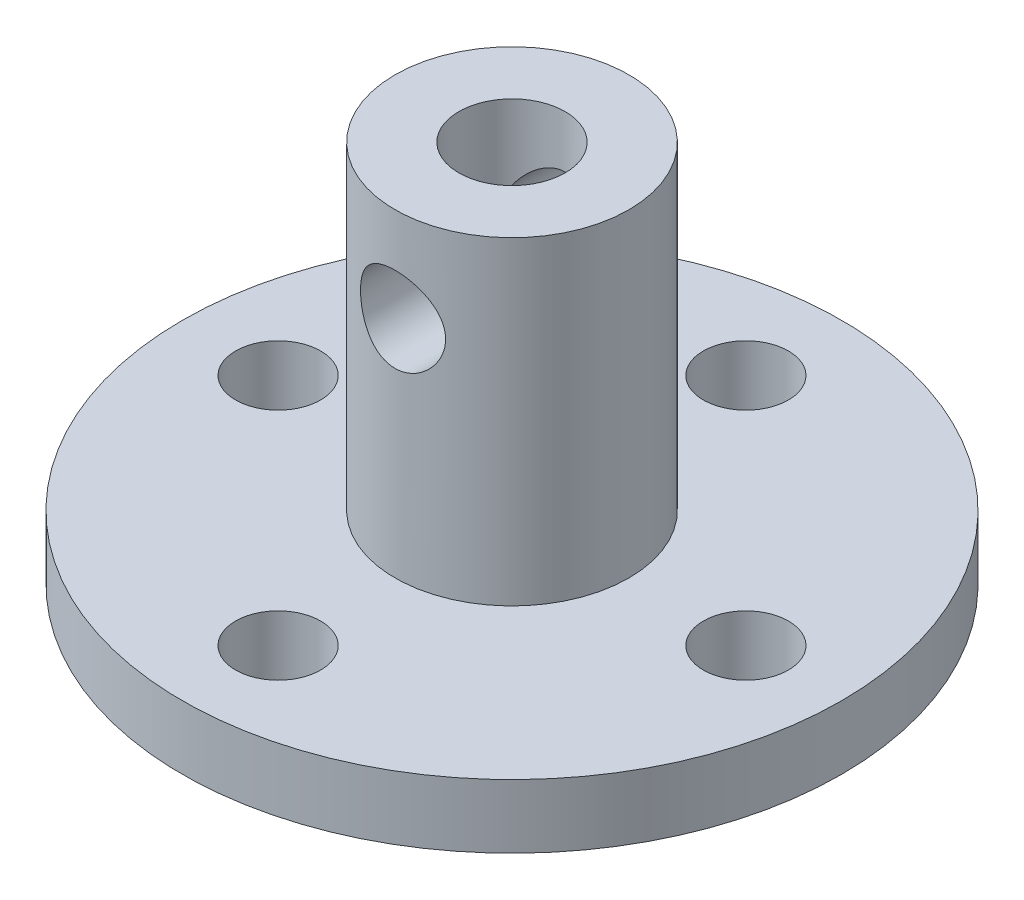
from build123d import *

# Parameters (mm, degrees)
CUT_EXTRUDE1_DEPTH      = 10
CUT_EXTRUDE1_DEPTH_BACK = 10
SKETCH2_R               = 2
SKETCH3_R               = 2
CUT_EXTRUDE2_DEPTH      = 10


with BuildPart() as part:
    # Sketch1 → Revolve1 (revolve)
    with BuildSketch(Plane.XY):
        Polygon((-2.5, 0), (-2.5, -18), (-15.5, -18), (-15.5, -15), (-5.5, -15), (-5.5, 0), align=None)
    revolve(axis=Axis((0, -76.950705693, 0), (0, 1, 0)))

    # Sketch2 → Cut-Extrude1 (cut, two sides: drawn at the far end of the back side and taken through both)
    with BuildSketch(Plane.XY.offset(-CUT_EXTRUDE1_DEPTH_BACK)):
        with Locations((0, -4.46288306)):
            Circle(SKETCH2_R)
    extrude(amount=CUT_EXTRUDE1_DEPTH + CUT_EXTRUDE1_DEPTH_BACK, mode=Mode.SUBTRACT)

    # Sketch3 → Cut-Extrude2 (cut)
    with BuildSketch(Plane(origin=(0, -15, 0), x_dir=(1, 0, 0), z_dir=(0, 1, 0))):
        with Locations((0, 11)):
            Circle(SKETCH3_R)
        with Locations((11, 0)):
            Circle(SKETCH3_R)
        with Locations((0, -11)):
            Circle(SKETCH3_R)
        with Locations((-11, 0)):
            Circle(SKETCH3_R)
    extrude(amount=-CUT_EXTRUDE2_DEPTH, mode=Mode.SUBTRACT)


solid = part.part
